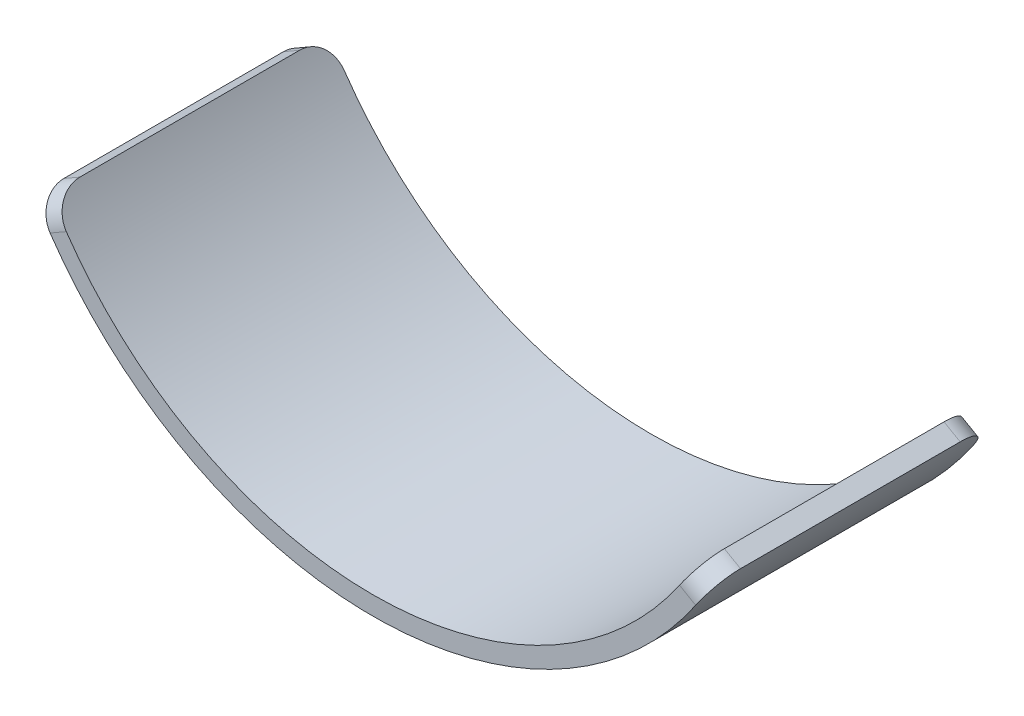
from build123d import *

# Parameters (mm, degrees)
BOSS_EXTRUDE1_DEPTH = 95
FILLET1_R           = 20


with BuildPart() as part:
    # Sketch1 → Boss-Extrude1 (new, symmetric)
    with BuildSketch(Plane.XY):
        with BuildLine():
            Line((-219.970452561, -127), (-230.968975189, -133.35))
            ThreePointArc((-230.968975189, -133.35), (0.181793833, -266.699938041), (231.150554347, -133.035))
            Line((231.150554347, -133.035), (220.143385093, -126.7))
            ThreePointArc((220.143385093, -126.7), (0.173136984, -253.999940991), (-219.970452561, -127))
        make_face()
    extrude(amount=BOSS_EXTRUDE1_DEPTH, both=True)

    # Fillet1
    fillet1_edges = [part.edges().sort_by_distance(p)[0] for p in [
        (225.64696972, -129.8675, 95),
        (225.64696972, -129.8675, -95),
        (-225.469713875, -130.175, -95),
        (-225.469713875, -130.175, 95),
    ]]
    fillet(fillet1_edges, radius=FILLET1_R)


solid = part.part
